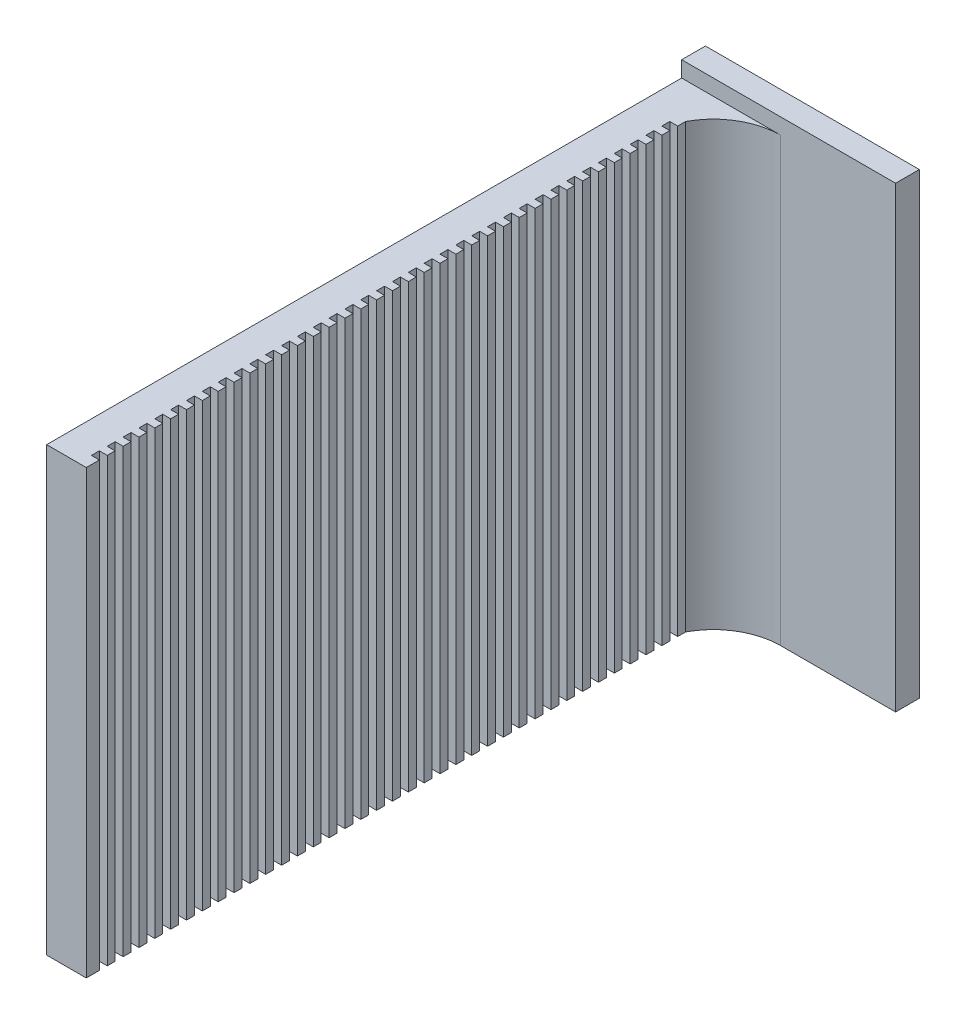
from build123d import *

# Parameters (mm, degrees)
BOSS_EXTRUDE1_DEPTH = 55.8
BOSS_EXTRUDE2_DEPTH = 55.8
SKETCH5_W           = 1
SKETCH5_H           = 55.8
CUT_EXTRUDE3_DEPTH  = 1
LPATTERN1_COUNT     = 37
LPATTERN1_PITCH     = 2
SKETCH6_W           = 27
SKETCH6_H           = 3
BOSS_EXTRUDE3_DEPTH = 2


with BuildPart() as part:
    # Sketch1 → Boss-Extrude1 (new body)
    with BuildSketch(Plane(origin=(0, 0, 0), x_dir=(1, 0, 0), z_dir=(0, 1, 0))):
        Polygon((0, 0), (0, 80.15), (22, 80.15), (22, 83.15), (0, 83.15), (-5, 83.15), (-5, 0), align=None)
    extrude(amount=BOSS_EXTRUDE1_DEPTH)

    # Sketch2 → Boss-Extrude2 (add)
    with BuildSketch(Plane(origin=(0, 55.8, 0), x_dir=(1, 0, 0), z_dir=(0, 1, 0))):
        with BuildLine():
            Line((0, 80.15), (7.5, 80.15))
            ThreePointArc((7.5, 80.15), (3.126786079, 78.938689869), (0, 75.65))
            Line((0, 75.65), (0, 80.15))
        make_face()
    extrude(amount=-BOSS_EXTRUDE2_DEPTH)

    # Sketch5 → Cut-Extrude3 (cut)
    with BuildSketch(Plane(origin=(0, 0, 0), x_dir=(0, 0, -1), z_dir=(1, 0, 0))):
        with Locations((74.15, 27.9)):
            Rectangle(SKETCH5_W, SKETCH5_H)
    cut_extrude3 = extrude(amount=-CUT_EXTRUDE3_DEPTH, mode=Mode.SUBTRACT)

    # LPattern1: Cut-Extrude3 ×37
    with Locations(*[(0, 0, i * LPATTERN1_PITCH) for i in range(1, LPATTERN1_COUNT)]):
        add(cut_extrude3, mode=Mode.SUBTRACT)

    # Sketch6 → Boss-Extrude3 (add)
    with BuildSketch(Plane(origin=(0, 55.8, 0), x_dir=(1, 0, 0), z_dir=(0, 1, 0))):
        with Locations((8.5, 81.65)):
            Rectangle(SKETCH6_W, SKETCH6_H)
    extrude(amount=BOSS_EXTRUDE3_DEPTH)


solid = part.part
